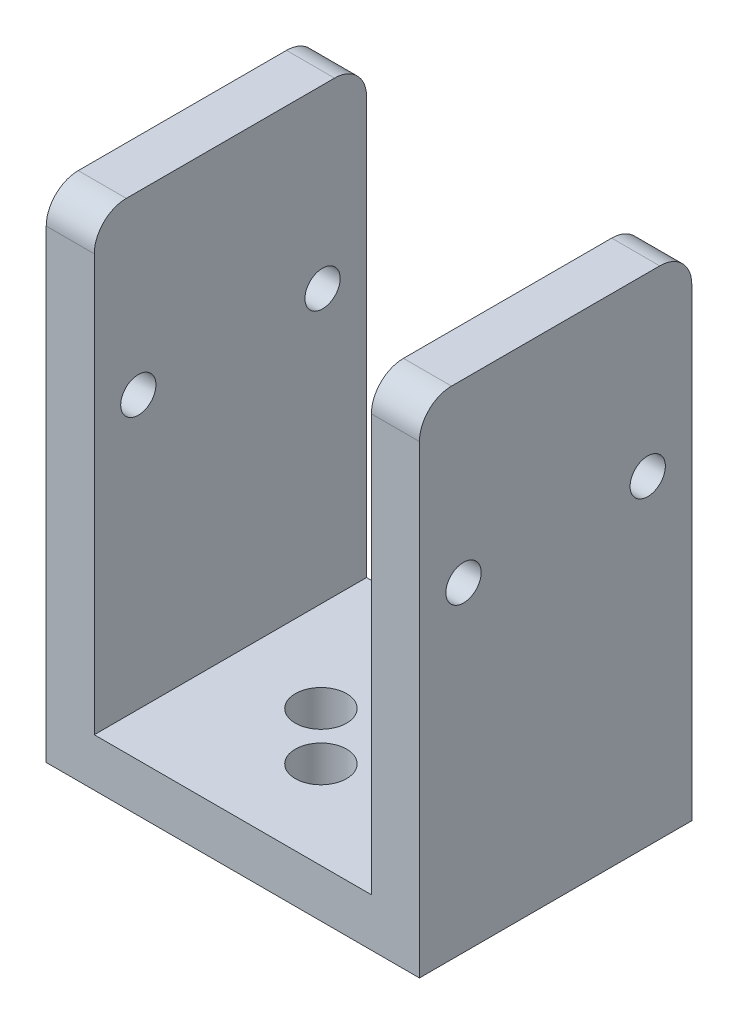
from build123d import *

# Parameters (mm, degrees)
SKETCH_1_W          = 17.3
SKETCH_1_H          = 17
SKETCH_1_R          = 1.6
EXTRUDE_1_DEPTH     = 3
SKETCH_2_W          = 3
SKETCH_2_H          = 17
EXTRUDE_2_DEPTH     = 31
FILLET_1_R          = 2
SKETCH_3_R          = 1.1
CUT_EXTRUDE_1_DEPTH = 28


with BuildPart() as part:
    # 草图1 → 凸台-拉伸1 (new body)
    with BuildSketch(Plane(origin=(0, 0, 0), x_dir=(1, 0, 0), z_dir=(0, 1, 0))):
        Rectangle(SKETCH_1_W, SKETCH_1_H)
        with Locations(Location((0, 3, 0), (0, 0, 270))):
            Circle(SKETCH_1_R, mode=Mode.SUBTRACT)
        with Locations(Location((3, 0, 0), (0, 0, 270))):
            Circle(SKETCH_1_R, mode=Mode.SUBTRACT)
        with Locations(Location((0, -3, 0), (0, 0, 90))):
            Circle(SKETCH_1_R, mode=Mode.SUBTRACT)
        with Locations(Location((-3, 0, 0), (0, 0, 90))):
            Circle(SKETCH_1_R, mode=Mode.SUBTRACT)
    extrude(amount=EXTRUDE_1_DEPTH)

    # 草图2 → 凸台-拉伸2 (add)
    with BuildSketch(Plane(origin=(0, 0, 0), x_dir=(1, 0, 0), z_dir=(0, 1, 0))):
        with Locations((10.15, 0)):
            Rectangle(SKETCH_2_W, SKETCH_2_H)
        with Locations((-10.15, 0)):
            Rectangle(SKETCH_2_W, SKETCH_2_H)
    extrude(amount=EXTRUDE_2_DEPTH)

    # 圆角1
    fillet_1_edges = [part.edges().sort_by_distance(p)[0] for p in [
        (-10.15, 31, -8.5),
        (-10.15, 31, 8.5),
        (10.15, 31, 8.5),
        (10.15, 31, -8.5),
    ]]
    fillet(fillet_1_edges, radius=FILLET_1_R)

    # 草图3 → 切除-拉伸1 (cut)
    with BuildSketch(Plane.ZY.offset(11.65)):
        with Locations((5.75, 20)):
            Circle(SKETCH_3_R)
        with Locations((-5.75, 20)):
            Circle(SKETCH_3_R)
    extrude(amount=-CUT_EXTRUDE_1_DEPTH, mode=Mode.SUBTRACT)


solid = part.part
